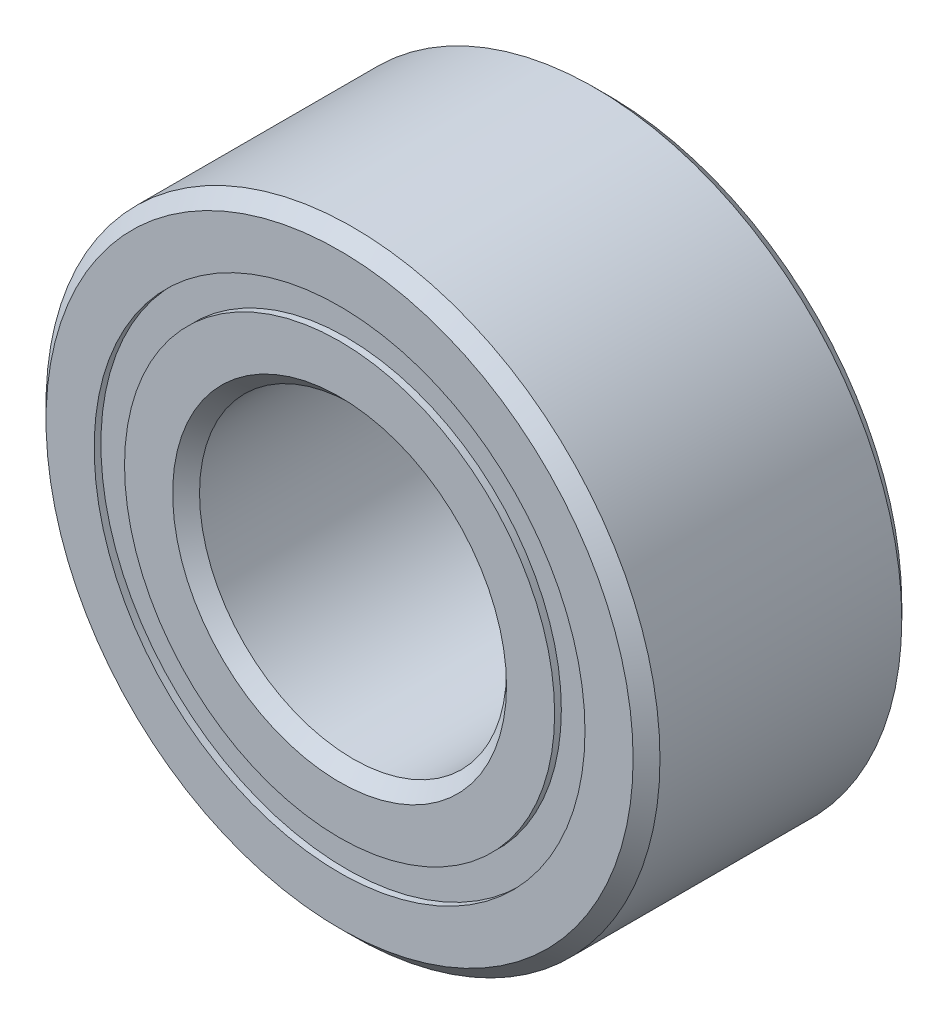
from build123d import *

# Parameters (mm, degrees)
CIRPATTERN1_COUNT = 10
SKETCH5_W         = 0.682768194
SKETCH5_H         = 0.313955164


with BuildPart() as part:
    # Sketch1 → Revolve1 (revolve)
    with BuildSketch(Plane(origin=(0, 0, 0), x_dir=(0, 0, -1), z_dir=(1, 0, 0)), mode=Mode.PRIVATE) as revolve1_sk:
        with BuildLine():
            Line((1.250442, 3.175), (-1.250442, 3.175))
            Line((-1.250442, 3.175), (-1.38938, 3.036062))
            Line((-1.38938, 3.036062), (-1.38938, 2.538227582))
            Line((-1.38938, 2.538227582), (-0.617502222, 2.538227582))
            ThreePointArc((-0.617502222, 2.538227582), (0, 3.018392806), (0.617502222, 2.538227582))
            Line((0.617502222, 2.538227582), (1.38938, 2.538227582))
            Line((1.38938, 2.538227582), (1.38938, 3.036062))
            Line((1.38938, 3.036062), (1.250442, 3.175))
        make_face()
    revolve(revolve1_sk.sketch.rotate(Axis((0, 0, 1.38938), (0, 0, -1)), 90), axis=Axis((0, 0, 1.38938), (0, 0, -1)))


with BuildPart() as body_2:
    # Sketch3 → Revolve3 (revolve)
    with BuildSketch(Plane(origin=(0, 0, 0), x_dir=(0, 0, -1), z_dir=(1, 0, 0)), mode=Mode.PRIVATE) as revolve3_sk:
        with BuildLine():
            Line((-0.617502222, 2.224272418), (-1.38938, 2.224272418))
            Line((-1.38938, 2.224272418), (-1.38938, 1.726438))
            Line((-1.38938, 1.726438), (-1.250442, 1.5875))
            Line((-1.250442, 1.5875), (1.250442, 1.5875))
            Line((1.250442, 1.5875), (1.38938, 1.726438))
            Line((1.38938, 1.726438), (1.38938, 2.224272418))
            Line((1.38938, 2.224272418), (0.617502222, 2.224272418))
            ThreePointArc((0.617502222, 2.224272418), (0, 1.744107194), (-0.617502222, 2.224272418))
        make_face()
    revolve(revolve3_sk.sketch.rotate(Axis((0, 0, 1.38938), (0, 0, -1)), 90), axis=Axis((0, 0, 1.38938), (0, 0, -1)))


with BuildPart() as body_3:
    # Sketch4 → Revolve4 (revolve)
    with BuildSketch(Plane(origin=(0, 0, 0), x_dir=(0, 0, -1), z_dir=(1, 0, 0))):
        with BuildLine():
            Line((-0.637142806, 2.38125), (0.637142806, 2.38125))
            ThreePointArc((0.637142806, 2.38125), (0, 3.018392806), (-0.637142806, 2.38125))
        make_face()
    revolve(axis=Axis((0, 2.38125, 0.637142806), (0, 0, -1)))


with BuildPart() as cirpattern1_1:
    # CirPattern1: pattern copy
    add(body_3.part.rotate(Axis((0, 0, 0), (0, 0, 1)), 1 * 360 / CIRPATTERN1_COUNT))


with BuildPart() as cirpattern1_2:
    # CirPattern1: pattern copy
    add(body_3.part.rotate(Axis((0, 0, 0), (0, 0, 1)), 2 * 360 / CIRPATTERN1_COUNT))


with BuildPart() as cirpattern1_3:
    # CirPattern1: pattern copy
    add(body_3.part.rotate(Axis((0, 0, 0), (0, 0, 1)), 3 * 360 / CIRPATTERN1_COUNT))


with BuildPart() as cirpattern1_4:
    # CirPattern1: pattern copy
    add(body_3.part.rotate(Axis((0, 0, 0), (0, 0, 1)), 4 * 360 / CIRPATTERN1_COUNT))


with BuildPart() as cirpattern1_5:
    # CirPattern1: pattern copy
    add(body_3.part.rotate(Axis((0, 0, 0), (0, 0, 1)), 5 * 360 / CIRPATTERN1_COUNT))


with BuildPart() as cirpattern1_6:
    # CirPattern1: pattern copy
    add(body_3.part.rotate(Axis((0, 0, 0), (0, 0, 1)), 6 * 360 / CIRPATTERN1_COUNT))


with BuildPart() as cirpattern1_7:
    # CirPattern1: pattern copy
    add(body_3.part.rotate(Axis((0, 0, 0), (0, 0, 1)), 7 * 360 / CIRPATTERN1_COUNT))


with BuildPart() as cirpattern1_8:
    # CirPattern1: pattern copy
    add(body_3.part.rotate(Axis((0, 0, 0), (0, 0, 1)), 8 * 360 / CIRPATTERN1_COUNT))


with BuildPart() as cirpattern1_9:
    # CirPattern1: pattern copy
    add(body_3.part.rotate(Axis((0, 0, 0), (0, 0, 1)), 9 * 360 / CIRPATTERN1_COUNT))


with BuildPart() as body_13:
    # Sketch5 → Revolve5 (revolve)
    with BuildSketch(Plane(origin=(0, 0, 0), x_dir=(0, 0, -1), z_dir=(1, 0, 0)), mode=Mode.PRIVATE) as revolve5_sk:
        with Locations((-0.978526903, 2.38125)):
            Rectangle(SKETCH5_W, SKETCH5_H)
        with Locations((0.978526903, 2.38125)):
            Rectangle(SKETCH5_W, SKETCH5_H)
    revolve(revolve5_sk.sketch.rotate(Axis((0, 0, 1.38938), (0, 0, -1)), 90), axis=Axis((0, 0, 1.38938), (0, 0, -1)))


solid = Compound([part.part, body_2.part, body_3.part, cirpattern1_1.part, cirpattern1_2.part, cirpattern1_3.part, cirpattern1_4.part, cirpattern1_5.part, cirpattern1_6.part, cirpattern1_7.part, cirpattern1_8.part, cirpattern1_9.part, body_13.part])
